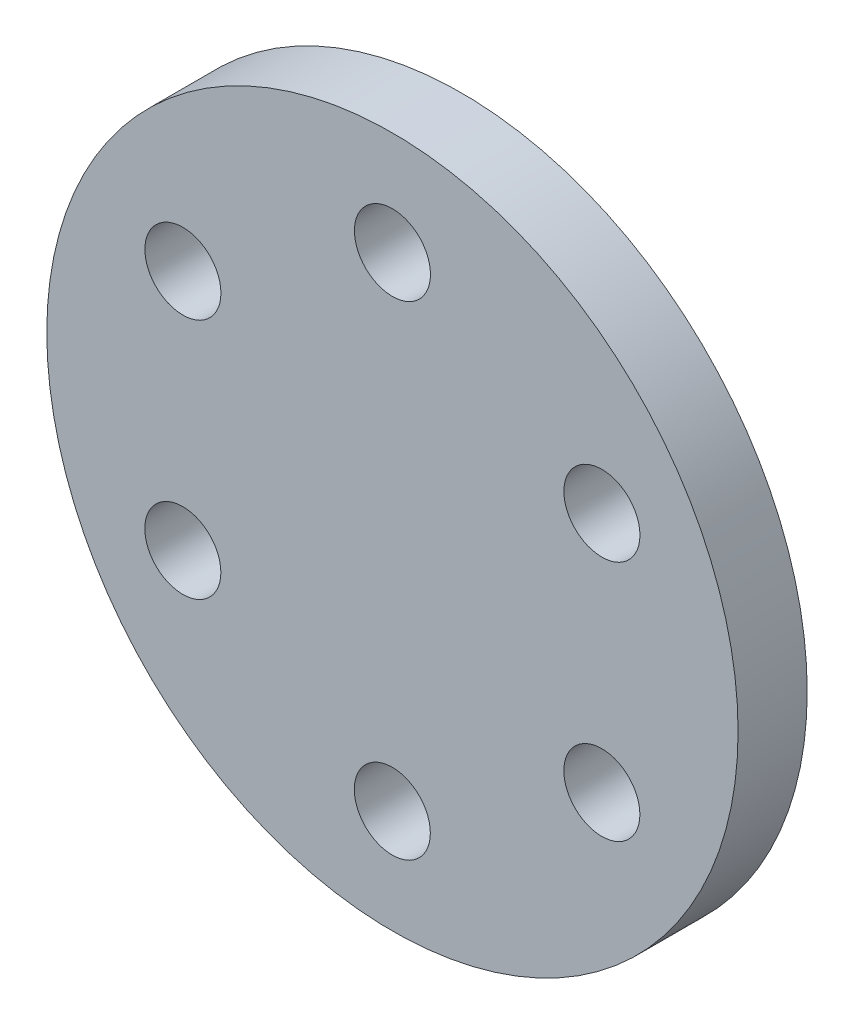
from build123d import *

# Parameters (mm, degrees)
ESBO_O1_R                = 50
RESSALTO_EXTRUS_O1_DEPTH = 10
ESBO_O2_R                = 5.5
CORTE_EXTRUS_O1_DEPTH    = 72.414284285


with BuildPart() as part:
    # Esboço1 → Ressalto-extrusão1 (new body)
    with BuildSketch(Plane.XY):
        Circle(ESBO_O1_R)
    extrude(amount=RESSALTO_EXTRUS_O1_DEPTH)

    # Esboço2 → Corte-extrusão1 (cut, through all)
    with BuildSketch(Plane.XY.offset(10)):
        with Locations((0, 35)):
            Circle(ESBO_O2_R)
        with Locations((30.302079877, 17.494913974)):
            Circle(ESBO_O2_R)
        with Locations((30.293270622, -17.5)):
            Circle(ESBO_O2_R)
        with Locations((-0.01761851, -34.989827948)):
            Circle(ESBO_O2_R)
        with Locations((-30.319698388, -17.484741922)):
            Circle(ESBO_O2_R)
        with Locations((-30.310889132, 17.510172052)):
            Circle(ESBO_O2_R)
    extrude(amount=-CORTE_EXTRUS_O1_DEPTH, mode=Mode.SUBTRACT)


solid = part.part
